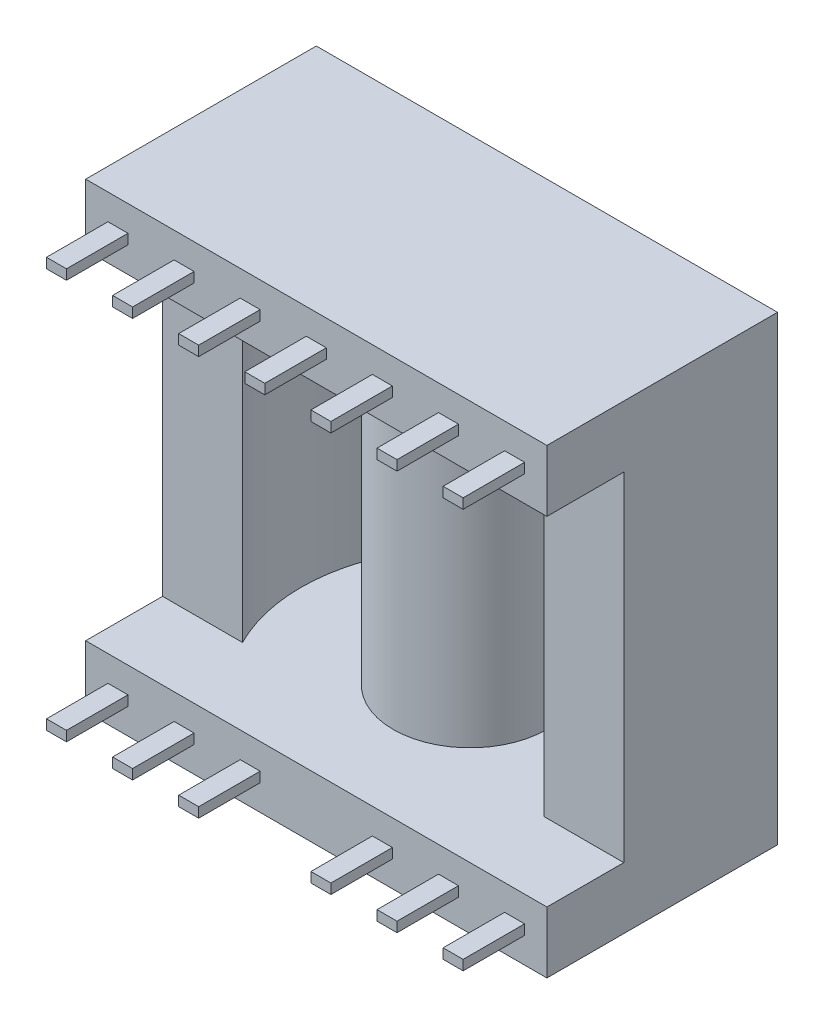
from build123d import *

# Parameters (mm, degrees)
EXTRUDE_1_DEPTH   = 11
SKETCH_1_R        = 5
EXTRUDE_1_2_DEPTH = 11
EXTRUDE_1_3_DEPTH = 11
SKETCH_2_W        = 30
SKETCH_2_H        = 10
EXTRUDE_2_DEPTH   = 4
SKETCH_3_R        = 5
EXTRUDE_3_DEPTH   = 11
SKETCH_4_W        = 30
SKETCH_4_H        = 10
EXTRUDE_4_DEPTH   = 4
SKETCH_5_W        = 30
SKETCH_5_H        = 4
EXTRUDE_5_DEPTH   = 5
SKETCH_6_W        = 1.3
SKETCH_6_H        = 0.65
EXTRUDE_6_DEPTH   = 4


with BuildPart() as part:
    # Эскиз1 → Бобышка-Вытянуть1 (new body)
    with BuildSketch(Plane(origin=(0, 0, 0), x_dir=(1, 0, 0), z_dir=(0, 1, 0))):
        with BuildLine():
            Line((0, 10), (0, 0))
            Line((0, 0), (5.202041029, 0))
            ThreePointArc((5.202041029, 0), (4, 5), (5.202041029, 10))
            Line((5.202041029, 10), (0, 10))
        make_face()
    extrude(amount=EXTRUDE_1_DEPTH)



with BuildPart() as body_2:
    # Эскиз1 → Extrude 1 2 (new body)
    with BuildSketch(Plane(origin=(0, 0, 0), x_dir=(1, 0, 0), z_dir=(0, 1, 0))):
        with Locations(Location((15, 5, 0), (0, 0, 270))):
            Circle(SKETCH_1_R)
    extrude(amount=EXTRUDE_1_2_DEPTH)


with BuildPart() as body_3:
    # Эскиз1 → Extrude 1 3 (new body)
    with BuildSketch(Plane(origin=(0, 0, 0), x_dir=(1, 0, 0), z_dir=(0, 1, 0))):
        with BuildLine():
            ThreePointArc((26, 5), (25.695268783, 2.428769622), (24.797958971, 0))
            Line((24.797958971, 0), (30, 0))
            Line((30, 0), (30, 10))
            Line((30, 10), (24.797958971, 10))
            ThreePointArc((24.797958971, 10), (25.695268783, 7.571230378), (26, 5))
        make_face()
    extrude(amount=EXTRUDE_1_3_DEPTH)


with BuildPart() as part_1:
    add(part.part)

    add(body_2.part)  # Бобышка-Вытянуть2 merges body 2

    add(body_3.part)  # Бобышка-Вытянуть2 merges body 3
    # Эскиз2 → Бобышка-Вытянуть2 (add)
    with BuildSketch(Plane.XZ):
        with Locations((15, -5)):
            Rectangle(SKETCH_2_W, SKETCH_2_H)
    extrude(amount=EXTRUDE_2_DEPTH)

    # Эскиз3 → Бобышка-Вытянуть3 (add)
    with BuildSketch(Plane(origin=(0, 11, 0), x_dir=(1, 0, 0), z_dir=(0, 1, 0))):
        with Locations(Location((15, 5, 0), (0, 0, 270))):
            Circle(SKETCH_3_R)
        with BuildLine():
            Line((24.797958971, 0), (30, 0))
            Line((30, 0), (30, 10))
            Line((30, 10), (24.797958971, 10))
            ThreePointArc((24.797958971, 10), (26, 5), (24.797958971, 0))
        make_face()
        with BuildLine():
            Line((5.202041029, 10), (0, 10))
            Line((0, 10), (0, 0))
            Line((0, 0), (5.202041029, 0))
            ThreePointArc((5.202041029, 0), (4, 5), (5.202041029, 10))
        make_face()
    extrude(amount=EXTRUDE_3_DEPTH)

    # Эскиз4 → Бобышка-Вытянуть4 (add)
    with BuildSketch(Plane(origin=(0, 22, 0), x_dir=(1, 0, 0), z_dir=(0, 1, 0))):
        with Locations((15, 5)):
            Rectangle(SKETCH_4_W, SKETCH_4_H)
    extrude(amount=EXTRUDE_4_DEPTH)

    # Эскиз5 → Бобышка-Вытянуть5 (add)
    with BuildSketch(Plane.XY):
        with Locations((15, 24)):
            Rectangle(SKETCH_5_W, SKETCH_5_H)
        with Locations((15, -2)):
            Rectangle(SKETCH_5_W, SKETCH_5_H)
    extrude(amount=EXTRUDE_5_DEPTH)

    # Эскиз6 → Бобышка-Вытянуть6 (add)
    with BuildSketch(Plane.XY.offset(5)):
        with Locations((6.4, 24)):
            Rectangle(SKETCH_6_W, SKETCH_6_H)
        with Locations((2.1, 24)):
            Rectangle(SKETCH_6_W, SKETCH_6_H)
        with Locations((10.7, 24)):
            Rectangle(SKETCH_6_W, SKETCH_6_H)
        with Locations((15, 24)):
            Rectangle(SKETCH_6_W, SKETCH_6_H)
        with Locations((19.3, 24)):
            Rectangle(SKETCH_6_W, SKETCH_6_H)
        with Locations((23.6, 24)):
            Rectangle(SKETCH_6_W, SKETCH_6_H)
        with Locations((27.9, 24)):
            Rectangle(SKETCH_6_W, SKETCH_6_H)
        with Locations((6.4, -2)):
            Rectangle(SKETCH_6_W, SKETCH_6_H)
        with Locations((2.1, -2)):
            Rectangle(SKETCH_6_W, SKETCH_6_H)
        with Locations((10.7, -2)):
            Rectangle(SKETCH_6_W, SKETCH_6_H)
        with Locations((23.6, -2)):
            Rectangle(SKETCH_6_W, SKETCH_6_H)
        with Locations((19.3, -2)):
            Rectangle(SKETCH_6_W, SKETCH_6_H)
        with Locations((27.9, -2)):
            Rectangle(SKETCH_6_W, SKETCH_6_H)
    extrude(amount=EXTRUDE_6_DEPTH)


solid = part_1.part
